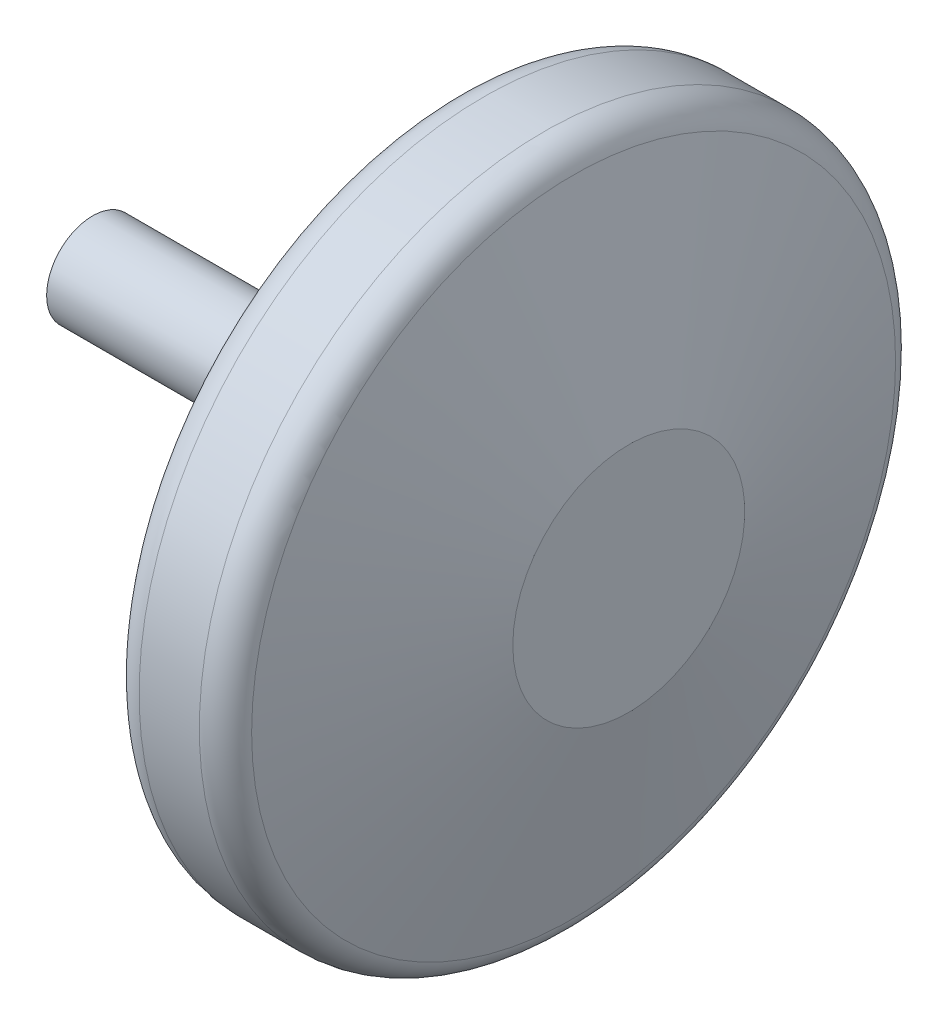
from build123d import *

# Parameters (mm, degrees)
FILLET_1_R = 2


with BuildPart() as part:
    # Эскиз1 → Повернуть1 (revolve)
    with BuildSketch(Plane.XY, mode=Mode.PRIVATE) as revolve_1_sk:
        Polygon((0, 0), (0, 3), (20, 3), (20, 7.57179677), (24, 22.5), (31, 22.5), (35, 7.57179677), (35, 0), (26, 0), align=None)
    revolve(revolve_1_sk.sketch.rotate(Axis((0, 0, 0), (1, 0, 0)), 90), axis=Axis((0, 0, 0), (1, 0, 0)))

    # Скругление1
    fillet_1_edges = [part.edges().sort_by_distance(p)[0] for p in [
        (31, 0, -22.5),
        (24, 0, -22.5),
    ]]
    fillet(fillet_1_edges, radius=FILLET_1_R)


solid = part.part
